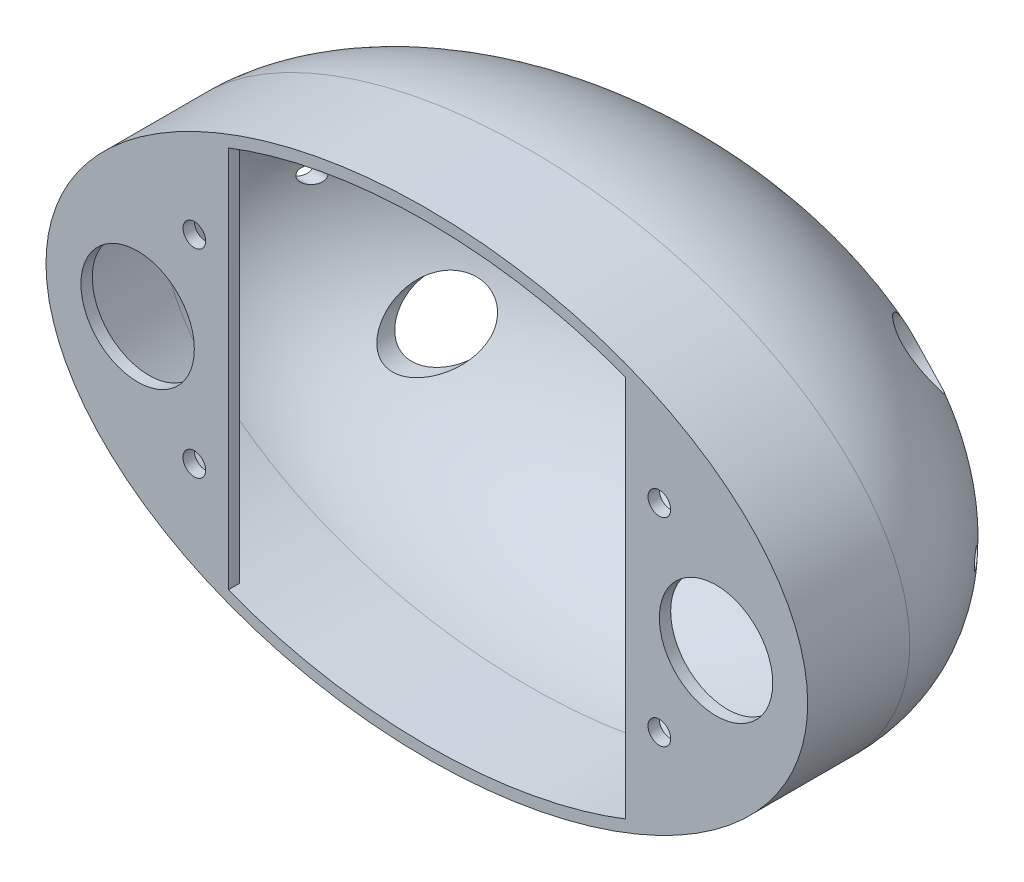
from build123d import *

# Parameters (mm, degrees)
REVOLVE_2_ANGLE          = 180
SKETCH_3_RX              = 67.156843781
SKETCH_3_RY              = 42
SKETCH_3_RX_2            = 65.156843781
SKETCH_3_RY_2            = 40
EXTRUDE_1_DEPTH          = 18
EXTRUDE_2_DEPTH          = 2
CUT_EXTRUDE_2_REACH      = 101.368
SKETCH_5_R               = 2
SKETCH_5_R_2             = 10
CUT_EXTRUDE_START        = -10
SKETCH_6_R               = 6
CUT_EXTRUDE_3_DEPTH      = 90.368212727
CUT_EXTRUDE_4_DEPTH      = 90.65512644
CUT_EXTRUDE_4_DEPTH_BACK = 90.65512644
SKETCH_7_R               = 1.5


with BuildPart() as part:
    # 草图1 → 旋转2 (revolve)
    with BuildSketch(Plane.XY):
        with BuildLine():
            Line((-67.156843781, 0), (-65.156843781, 0))
            add(Edge.make_bspline(
                [(-65.156843781, 0), (-65.156843781, -40), (0, -40), (65.156843781, -40), (65.156843781, 0)],
                knots=[3.141592654, 3.141592654, 3.141592654, 4.71238898, 4.71238898, 6.283185307, 6.283185307, 6.283185307], degree=2, weights=[1, 0.707106781, 1, 0.707106781, 1]))
            Line((65.156843781, 0), (67.156843781, 0))
            add(Edge.make_bspline(
                [(-67.156843781, 0), (-67.156843781, -42), (0, -42), (67.156843781, -42), (67.156843781, 0)],
                knots=[3.141592654, 3.141592654, 3.141592654, 4.71238898, 4.71238898, 6.283185307, 6.283185307, 6.283185307], degree=2, weights=[1, 0.707106781, 1, 0.707106781, 1]))
        make_face()
    revolve(axis=Axis((-67.156843781, 0, 0), (1, 0, 0)), revolution_arc=REVOLVE_2_ANGLE)

    # 草图3 → 凸台-拉伸1 (add)
    with BuildSketch(Plane.XY):
        with Locations(Location((0, 0), (0, 0, 0))):
            Ellipse(SKETCH_3_RX, SKETCH_3_RY)
        with Locations(Location((0, 0), (0, 0, 0))):
            Ellipse(SKETCH_3_RX_2, SKETCH_3_RY_2, mode=Mode.SUBTRACT)
    extrude(amount=EXTRUDE_1_DEPTH)

    # 草图4 → 凸台-拉伸2 (add)
    with BuildSketch(Plane.XY.offset(18)):
        with BuildLine():
            Line((-35, 33.73907804), (-35, -33.73907804))
            add(Edge.make_bspline(
                [(-35, 33.73907804), (-121.297551187, 0), (-35, -33.73907804)],
                knots=[2.137869175, 2.137869175, 2.137869175, 4.145316132, 4.145316132, 4.145316132], degree=2, weights=[1, 0.537165368, 1]))
        make_face()
        with BuildLine():
            Line((35, 33.73907804), (35, -33.73907804))
            add(Edge.make_bspline(
                [(35, -33.73907804), (121.297551187, 0), (35, 33.73907804)],
                knots=[2.137869175, 2.137869175, 2.137869175, 4.145316132, 4.145316132, 4.145316132], degree=2, weights=[1, 0.537165368, 1]))
        make_face()
    extrude(amount=-EXTRUDE_2_DEPTH)

    # 草图5 → 切除-拉伸2 (cut, up to next)
    with BuildSketch(Plane.XY.offset(18), mode=Mode.PRIVATE) as cut_extrude_2_sk1:
        with Locations((41, 17.5)):
            Circle(SKETCH_5_R)
    cut_extrude_2_tool1 = extrude(cut_extrude_2_sk1.sketch, amount=-CUT_EXTRUDE_2_REACH, mode=Mode.PRIVATE) & part.part
    # 草图5 → 切除-拉伸2 (cut, up to next)
    with BuildSketch(Plane.XY.offset(18), mode=Mode.PRIVATE) as cut_extrude_2_sk2:
        with Locations(Location((41, -17.5, 0), (0, 0, 180))):
            Circle(SKETCH_5_R)
    cut_extrude_2_tool2 = extrude(cut_extrude_2_sk2.sketch, amount=-CUT_EXTRUDE_2_REACH, mode=Mode.PRIVATE) & part.part
    # 草图5 → 切除-拉伸2 (cut, up to next)
    with BuildSketch(Plane.XY.offset(18), mode=Mode.PRIVATE) as cut_extrude_2_sk3:
        with Locations((-41, -17.5)):
            Circle(SKETCH_5_R)
    cut_extrude_2_tool3 = extrude(cut_extrude_2_sk3.sketch, amount=-CUT_EXTRUDE_2_REACH, mode=Mode.PRIVATE) & part.part
    # 草图5 → 切除-拉伸2 (cut, up to next)
    with BuildSketch(Plane.XY.offset(18), mode=Mode.PRIVATE) as cut_extrude_2_sk4:
        with Locations((-41, 17.5)):
            Circle(SKETCH_5_R)
    cut_extrude_2_tool4 = extrude(cut_extrude_2_sk4.sketch, amount=-CUT_EXTRUDE_2_REACH, mode=Mode.PRIVATE) & part.part
    # 草图5 → 切除-拉伸2 (cut, up to next)
    with BuildSketch(Plane.XY.offset(18), mode=Mode.PRIVATE) as cut_extrude_2_sk5:
        with Locations((51, 0)):
            Circle(SKETCH_5_R_2)
    cut_extrude_2_tool5 = extrude(cut_extrude_2_sk5.sketch, amount=-CUT_EXTRUDE_2_REACH, mode=Mode.PRIVATE) & part.part
    # 草图5 → 切除-拉伸2 (cut, up to next)
    with BuildSketch(Plane.XY.offset(18), mode=Mode.PRIVATE) as cut_extrude_2_sk6:
        with Locations((-51, 0)):
            Circle(SKETCH_5_R_2)
    cut_extrude_2_tool6 = extrude(cut_extrude_2_sk6.sketch, amount=-CUT_EXTRUDE_2_REACH, mode=Mode.PRIVATE) & part.part
    add(cut_extrude_2_tool1.solids().sort_by_distance((41, 17.5, 18))[0], mode=Mode.SUBTRACT)
    add(cut_extrude_2_tool2.solids().sort_by_distance((41, -17.5, 18))[0], mode=Mode.SUBTRACT)
    add(cut_extrude_2_tool3.solids().sort_by_distance((-41, -17.5, 18))[0], mode=Mode.SUBTRACT)
    add(cut_extrude_2_tool4.solids().sort_by_distance((-41, 17.5, 18))[0], mode=Mode.SUBTRACT)
    add(cut_extrude_2_tool5.solids().sort_by_distance((51, 0, 18))[0], mode=Mode.SUBTRACT)
    add(cut_extrude_2_tool6.solids().sort_by_distance((-51, 0, 18))[0], mode=Mode.SUBTRACT)

    # 草图6 → 切除-拉伸3 (cut, through all)
    with BuildSketch(Plane.XY.offset(18).offset(CUT_EXTRUDE_START)):
        with Locations((41, -17.5)):
            Circle(SKETCH_6_R)
        with Locations((41, 17.5)):
            Circle(SKETCH_6_R)
        with Locations((-41, 17.5)):
            Circle(SKETCH_6_R)
        with Locations((-41, -17.5)):
            Circle(SKETCH_6_R)
    extrude(amount=-CUT_EXTRUDE_3_DEPTH, mode=Mode.SUBTRACT)

    # 草图7 → 切除-拉伸4 (cut, two sides: drawn at the far end of the back side and taken through both)
    with BuildSketch(Plane(origin=(0, 0, 0), x_dir=(0, 0, -1), z_dir=(1, 0, 0)).offset(-CUT_EXTRUDE_4_DEPTH_BACK)):
        with Locations((19, 0)):
            Circle(SKETCH_7_R)
        with Locations((29, 0)):
            Circle(SKETCH_7_R)
    extrude(amount=CUT_EXTRUDE_4_DEPTH + CUT_EXTRUDE_4_DEPTH_BACK, mode=Mode.SUBTRACT)


solid = part.part
